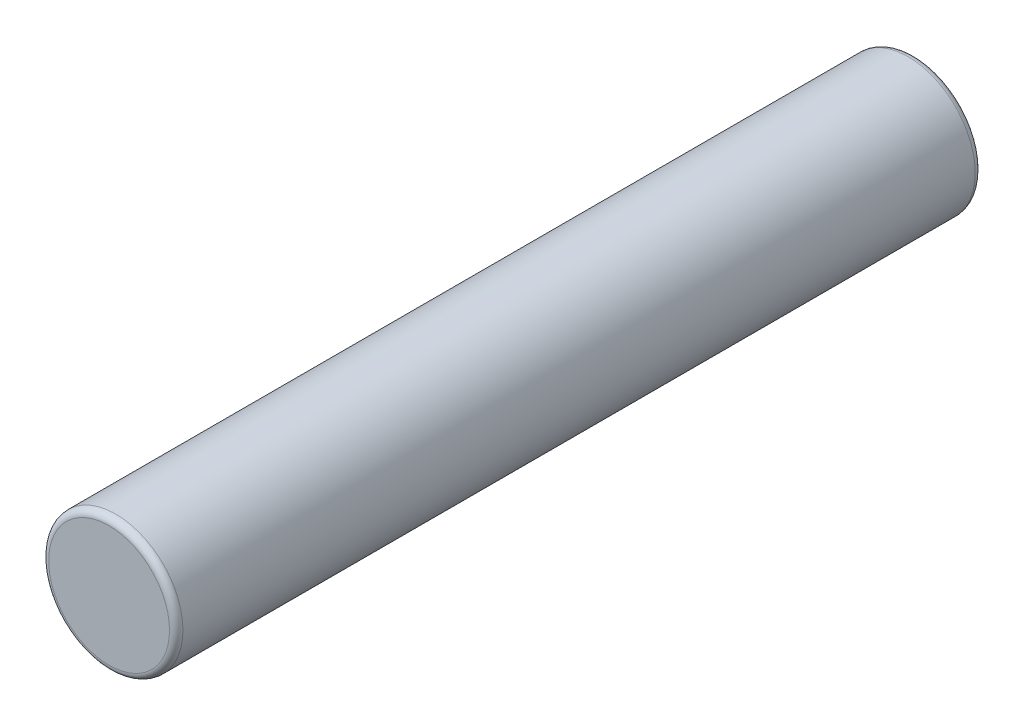
from build123d import *

# Parameters (mm, degrees)
SKETCH1_R      = 1
EXTRUDE1_DEPTH = 12
FILLET1_R      = 0.1


with BuildPart() as part:
    # Sketch1 → Extrude1 (new body)
    with BuildSketch(Plane.XY):
        Circle(SKETCH1_R)
    extrude(amount=EXTRUDE1_DEPTH)

    # Fillet1
    fillet1_edges = [part.edges().sort_by_distance(p)[0] for p in [
        (-1, 0, 0),
        (-1, 0, 12),
    ]]
    fillet(fillet1_edges, radius=FILLET1_R)


solid = part.part
